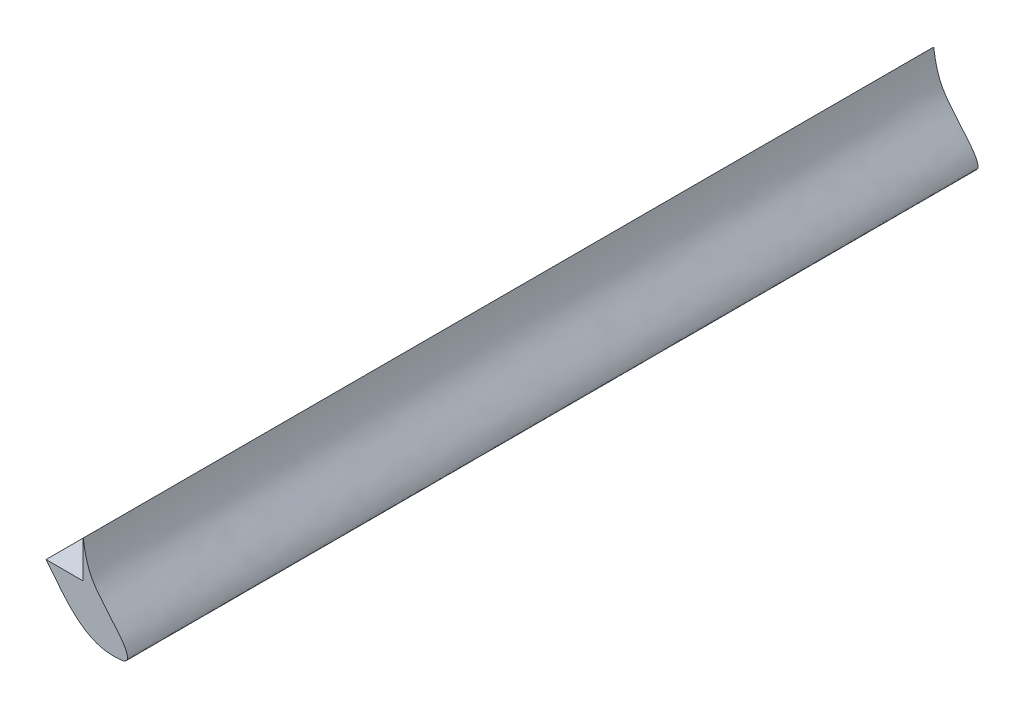
from build123d import *

# Parameters (mm, degrees)
BOSS_EXTRUDE1_DEPTH = 68.58


with BuildPart() as part:
    # Sketch2 → Boss-Extrude1 (new body)
    with BuildSketch(Plane.XY):
        with BuildLine():
            Line((0, 0), (0, 3))
            add(Edge.make_bspline(
                [(2.813614935, -4), (4.282644072, -4.020586248), (1.441229709, -0.309933447), (0.338549253, 0.433022709), (0, 3)],
                knots=[0, 0, 0, 0, 0.345394544, 1, 1, 1, 1], degree=3))
            add(Edge.make_bspline(
                [(-3, 0), (-1.927812511, -1.300677759), (-0.321687318, -3.75576279), (2.216982297, -4.062175657), (2.813614935, -4)],
                knots=[0, 0, 0, 0, 0.755604588, 1, 1, 1, 1], degree=3))
            Line((-3, 0), (0, 0))
        make_face()
    extrude(amount=-BOSS_EXTRUDE1_DEPTH)


solid = part.part
